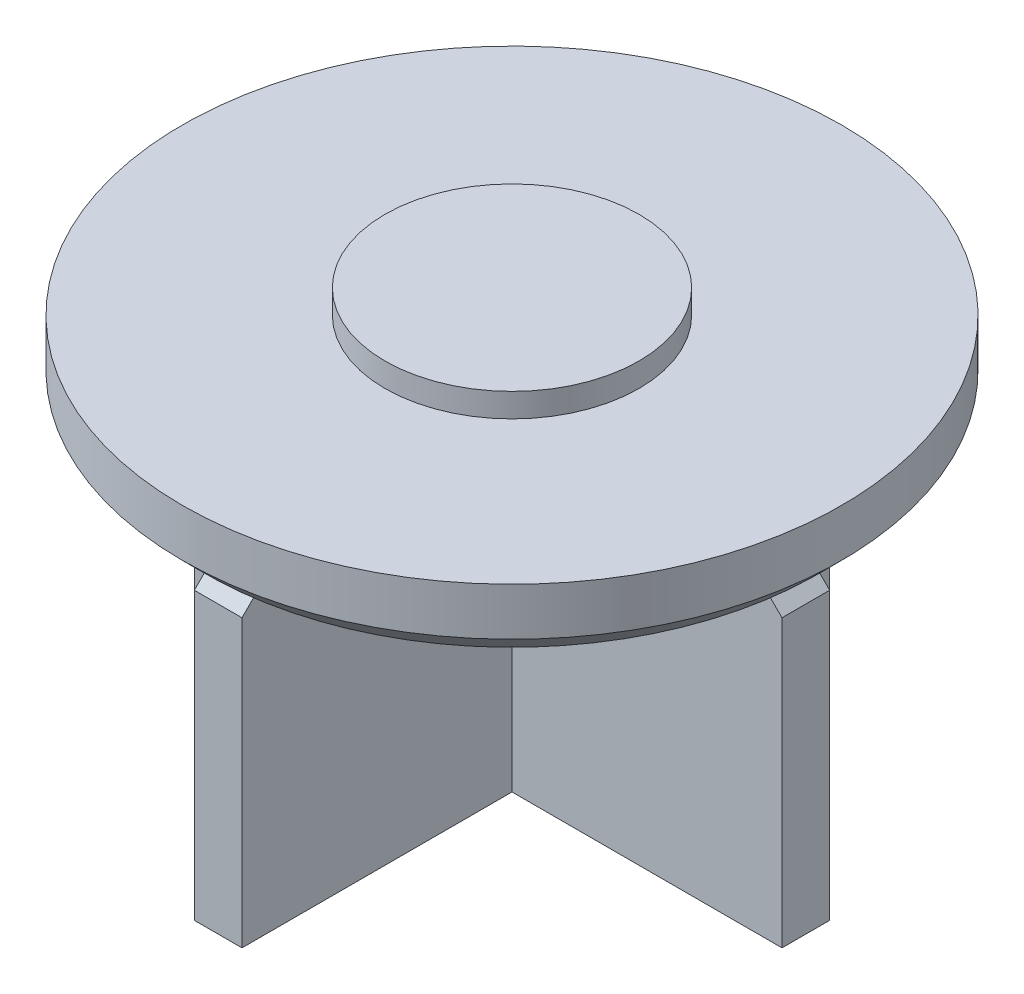
from build123d import *

# Parameters (mm, degrees)
BOSS_EXTRUDE1_DEPTH = 3
CIRPATTERN1_COUNT   = 4


with BuildPart() as part:
    # Sketch1 → Revolve1 (revolve)
    with BuildSketch(Plane.XY, mode=Mode.PRIVATE) as revolve1_sk:
        Polygon((0, 0), (-16, 0), (-16, -3), (-41.5, -3), (-41.5, -9), (-38.5, -12), (0, -12), align=None)
    revolve(revolve1_sk.sketch.rotate(Axis((0, -12, 0), (0, 1, 0)), 270), axis=Axis((0, -12, 0), (0, 1, 0)))

    # Sketch2 → Boss-Extrude1 (add, symmetric)
    with BuildSketch(Plane.XY):
        Polygon((0, -12), (0, -52), (37, -52), (37, -16), (33, -12), align=None)
    boss_extrude1 = extrude(amount=BOSS_EXTRUDE1_DEPTH, both=True)

    # CirPattern1: Boss-Extrude1 ×4 about axis
    cirpattern1_axis = Axis((0, 0, 0), (0, 1, 0))
    for i in range(1, CIRPATTERN1_COUNT):
        add(boss_extrude1.rotate(cirpattern1_axis, i * 360 / CIRPATTERN1_COUNT))


solid = part.part
